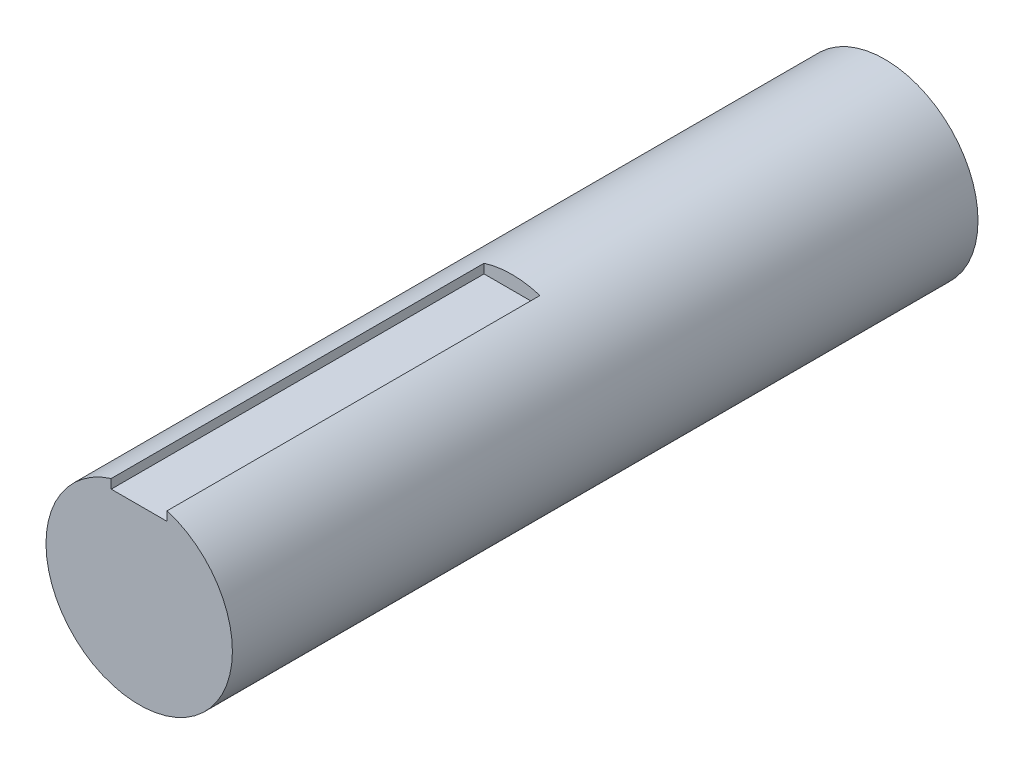
from build123d import *

# Parameters (mm, degrees)
SKETCH_1_R          = 2.5
EXTRUDE_1_DEPTH     = 20
SKETCH_2_W          = 1.5
SKETCH_2_H          = 0.668024243
CUT_EXTRUDE_1_DEPTH = 10


with BuildPart() as part:
    # 草图1 → 拉伸1 (new body)
    with BuildSketch(Plane.XY):
        Circle(SKETCH_1_R)
    extrude(amount=EXTRUDE_1_DEPTH)

    # 草图2 → 切除-拉伸1 (cut)
    with BuildSketch(Plane.XY.offset(20)):
        with Locations((0, 2.470998364)):
            Rectangle(SKETCH_2_W, SKETCH_2_H)
    extrude(amount=-CUT_EXTRUDE_1_DEPTH, mode=Mode.SUBTRACT)


solid = part.part
